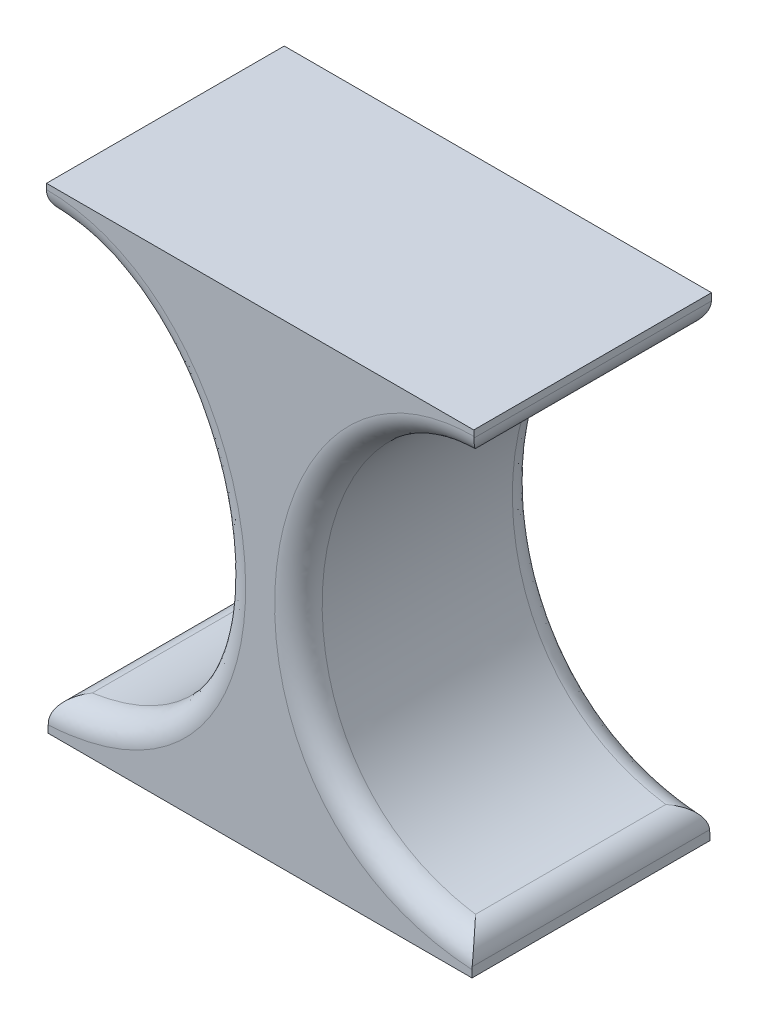
from build123d import *

# Parameters (mm, degrees)
BOSS_EXTRUDE1_DEPTH = 5
FILLET1_R           = 0.5


with BuildPart() as part:
    # Sketch1 → Boss-Extrude1 (new body)
    with BuildSketch(Plane.XY):
        with BuildLine():
            Line((-4.492753623, 3.605072464), (-4.492753623, 4.221014493))
            Line((-4.492753623, 4.221014493), (4.492753623, 4.221014493))
            Line((4.492753623, 4.221014493), (4.492753623, 3.605072464))
            add(Edge.make_bspline(
                [(4.456521739, -5.126811594), (-1.030105298, -4.776601358), (0.235507246, 3.605072464), (4.492753623, 3.605072464)],
                knots=[0, 0, 0, 0, 1, 1, 1, 1], degree=3))
            Line((4.456521739, -5.126811594), (4.456521739, -5.778985507))
            Line((4.456521739, -5.778985507), (-4.456521739, -5.778985507))
            Line((-4.456521739, -5.778985507), (-4.456521739, -5.126811594))
            add(Edge.make_bspline(
                [(-4.456521739, -5.126811594), (1.030105298, -4.776601358), (-0.235507246, 3.605072464), (-4.492753623, 3.605072464)],
                knots=[0, 0, 0, 0, 1, 1, 1, 1], degree=3))
        make_face()
    extrude(amount=BOSS_EXTRUDE1_DEPTH)

    # Fillet1
    fillet1_edges = [part.edges().sort_by_distance(p)[0] for p in [
        (-0.809667973, -0.814408993, 0),
        (-4.492753623, 3.605072464, 2.5),
        (4.492753623, 3.605072464, 2.5),
        (4.456521739, -5.126811594, 2.5),
        (-4.456521739, -5.126811594, 2.5),
        (0.809667973, -0.814408993, 5),
        (-0.809667973, -0.814408993, 5),
        (0.809667973, -0.814408993, 0),
    ]]
    fillet(fillet1_edges, radius=FILLET1_R)


solid = part.part
